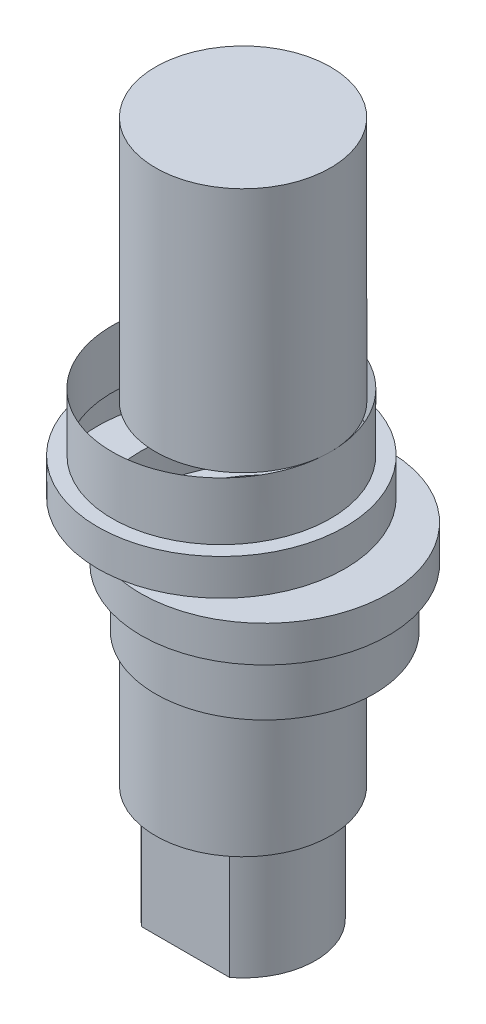
from build123d import *

# Parameters (mm, degrees)
SKETCH1_W           = 6.05
SKETCH1_H           = 17
SKETCH1_H_2         = 4
SKETCH1_H_3         = 5
SKETCH1_H_4         = 10
SKETCH1_5_W         = 3
SKETCH1_5_H         = 4
SKETCH1_6_W         = 3
SKETCH1_6_H         = 4
SKETCH2_W           = 8.55
SKETCH2_H           = 2.5
SKETCH2_3_W         = 8.55
SKETCH2_3_H         = 2.5
BOSS_EXTRUDE1_DEPTH = 8
SKETCH4_R           = 1.55
CUT_EXTRUDE1_DEPTH  = 8


with BuildPart() as part:
    # Sketch1 → Revolve4 (revolve)
    with BuildSketch(Plane.XY, mode=Mode.PRIVATE) as revolve4_sk:
        with Locations((-3.025, 31.5)):
            Rectangle(SKETCH1_W, SKETCH1_H)
        with Locations((-3.025, 21)):
            Rectangle(SKETCH1_W, SKETCH1_H_2)
        with Locations((-3.025, 16.5)):
            Rectangle(SKETCH1_W, SKETCH1_H_3)
        with Locations((-3.025, 12)):
            Rectangle(SKETCH1_W, SKETCH1_H_2)
        with Locations((-3.025, 5)):
            Rectangle(SKETCH1_W, SKETCH1_H_4)
    revolve(revolve4_sk.sketch.rotate(Axis((0, 0, 0), (0, 1, 0)), 270), axis=Axis((0, 0, 0), (0, 1, 0)))

    # Sketch1<5> → Revolve5 (revolve)
    with BuildSketch(Plane.XY, mode=Mode.PRIVATE) as revolve5_sk:
        with Locations((-7.55, 21)):
            Rectangle(SKETCH1_5_W, SKETCH1_5_H)
    revolve(revolve5_sk.sketch.rotate(Axis((-1.5, 0, 0), (0, 1, 0)), 180), axis=Axis((-1.5, 0, 0), (0, 1, 0)))

    # Sketch1<6> → Revolve6 (revolve)
    with BuildSketch(Plane.XY, mode=Mode.PRIVATE) as revolve6_sk:
        with Locations((7.55, 12)):
            Rectangle(SKETCH1_6_W, SKETCH1_6_H)
    revolve(revolve6_sk.sketch.rotate(Axis((1.5, 0, 0), (0, 1, 0)), 180), axis=Axis((1.5, 0, 0), (0, 1, 0)))

    # Sketch2 → Revolve7 (revolve)
    with BuildSketch(Plane.XY, mode=Mode.PRIVATE) as revolve7_sk:
        with Locations((-5.775, 17.75)):
            Rectangle(SKETCH2_W, SKETCH2_H)
    revolve(revolve7_sk.sketch.rotate(Axis((-1.5, 19, 0), (0, -1, 0)), 270), axis=Axis((-1.5, 19, 0), (0, -1, 0)))

    # Sketch2<3> → Revolve8 (revolve)
    with BuildSketch(Plane.XY, mode=Mode.PRIVATE) as revolve8_sk:
        with Locations((5.775, 15.25)):
            Rectangle(SKETCH2_3_W, SKETCH2_3_H)
    revolve(revolve8_sk.sketch.rotate(Axis((1.5, 19, 0), (0, -1, 0)), 90), axis=Axis((1.5, 19, 0), (0, -1, 0)))

    # Sketch3 → Boss-Extrude1 (add)
    with BuildSketch(Plane.XZ):
        with BuildLine():
            Line((3.041220715, 3.96875), (-3.041220715, 3.96875))
            ThreePointArc((-3.041220715, 3.96875), (-5, 0), (-3.041220715, -3.96875))
            Line((-3.041220715, -3.96875), (3.041220715, -3.96875))
            ThreePointArc((3.041220715, -3.96875), (4.483642692, -2.212904926), (5, 0))
            ThreePointArc((5, 0), (4.483642692, 2.212904926), (3.041220715, 3.96875))
        make_face()
    extrude(amount=BOSS_EXTRUDE1_DEPTH)

    # Sketch4 → Cut-Extrude1 (cut)
    with BuildSketch(Plane.XZ.offset(8)):
        with Locations(Location((0, 0, 0), (0, 0, 270))):
            Circle(SKETCH4_R)
    extrude(amount=-CUT_EXTRUDE1_DEPTH, mode=Mode.SUBTRACT)


solid = part.part
